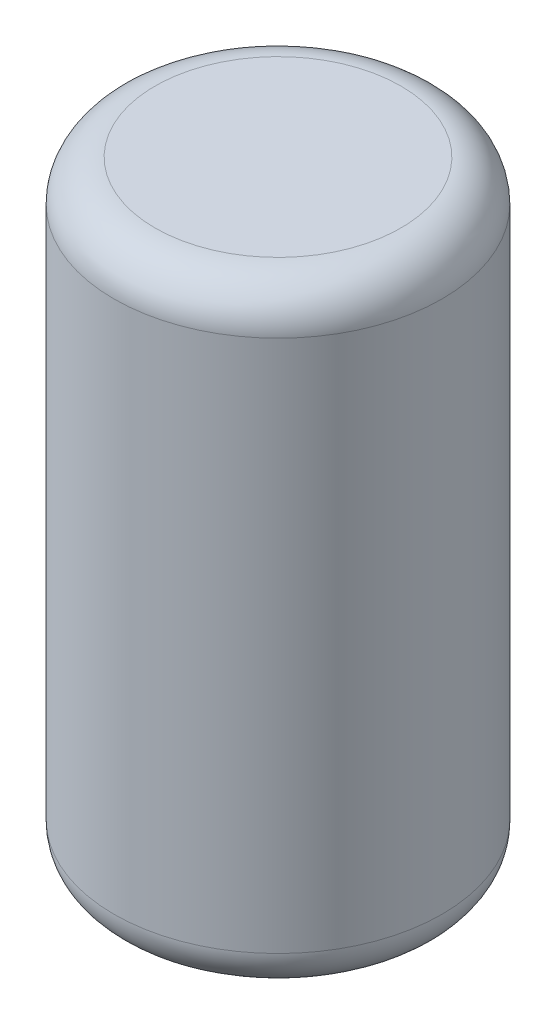
from build123d import *

# Parameters (mm, degrees)
SKETCH1_R           = 4
BOSS_EXTRUDE1_DEPTH = 15
FILLET1_R           = 1
SCALE1_SCALE        = 0.7


with BuildPart() as part:
    # Sketch1 → Boss-Extrude1 (new body)
    with BuildSketch(Plane(origin=(0, 0, 0), x_dir=(1, 0, 0), z_dir=(0, 1, 0))):
        with Locations(Location((0, 0, 0), (0, 0, 270))):
            Circle(SKETCH1_R)
    extrude(amount=BOSS_EXTRUDE1_DEPTH)

    # Fillet1
    fillet1_edges = [part.edges().sort_by_distance(p)[0] for p in [
        (0, 0, -4),
        (0, 15, -4),
    ]]
    fillet(fillet1_edges, radius=FILLET1_R)


with BuildPart() as part_1:
    # Scale1: scaled about (0, 7.5, 0)
    add(part.part.scale(SCALE1_SCALE).moved(Location((0, 2.25, 0))))


solid = part_1.part
